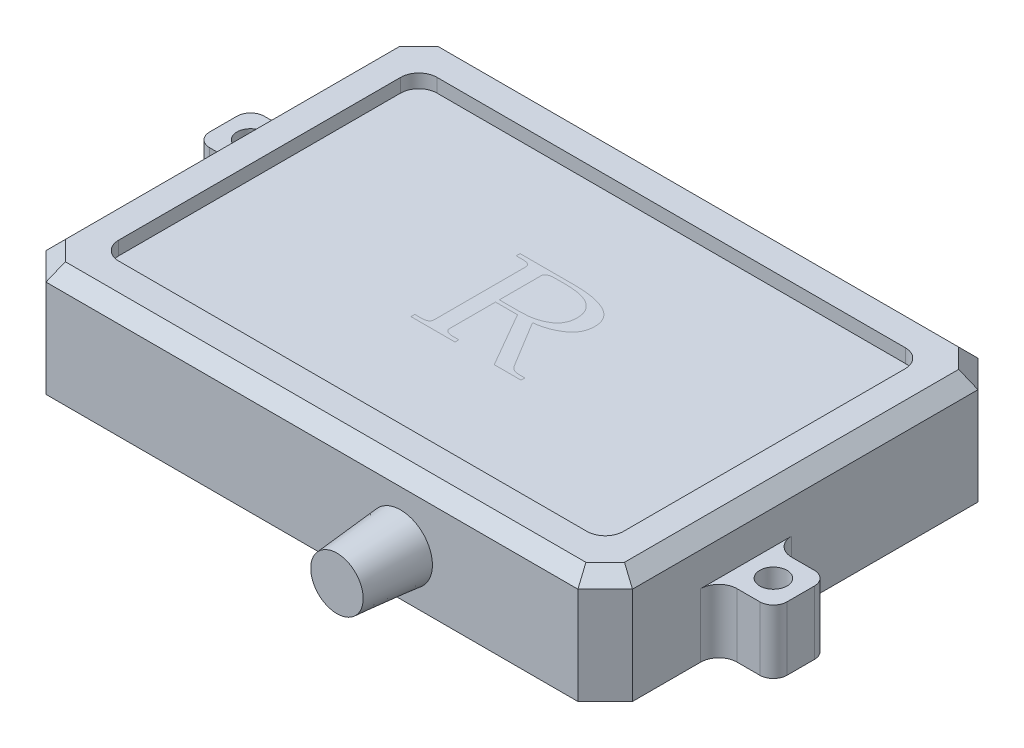
from build123d import *

# Parameters (mm, degrees)
EXTRUDE_1_DEPTH     = 12.2
CHAMFER_1_SIZE      = 1.5
CUT_EXTRUDE_1_DEPTH = 1.5
SKETCH_3_R          = 1.5
EXTRUDE_2_DEPTH     = 7
FILLET_1_R          = 2
SKETCH_4_R          = 3.5
EXTRUDE_3_DEPTH     = 7
EXTRUDE_3_TAPER     = 5
SKETCH_5_W          = 8
SKETCH_5_H          = 9
CUT_EXTRUDE_2_DEPTH = 2
SKETCH_6_R          = 2
SKETCH_6_W          = 6
SKETCH_6_H          = 1.5
CUT_EXTRUDE_3_DEPTH = 3


with BuildPart() as part:
    # 草图1 → 凸台-拉伸1 (new body)
    with BuildSketch(Plane(origin=(0, 0, 0), x_dir=(1, 0, 0), z_dir=(0, 1, 0))):
        Polygon((-32.25, 19), (-29.25, 22), (29.25, 22), (32.25, 19), (32.25, -19), (29.25, -22), (-29.25, -22), (-32.25, -19), align=None)
    extrude(amount=EXTRUDE_1_DEPTH)

    # 倒角1
    chamfer_1_edges = [part.edges().sort_by_distance(p)[0] for p in [
        (0, 12.2, 22),
        (30.75, 12.2, 20.5),
        (32.25, 12.2, 0),
        (30.75, 12.2, -20.5),
        (0, 12.2, -22),
        (-30.75, 12.2, -20.5),
        (-32.25, 12.2, 0),
        (-30.75, 12.2, 20.5),
    ]]
    chamfer(chamfer_1_edges, length=CHAMFER_1_SIZE)

    # 草图2 → 切除-拉伸1 (cut)
    with BuildSketch(Plane(origin=(0, 12.2, 0), x_dir=(1, 0, 0), z_dir=(0, 1, 0))):
        with BuildLine():
            Line((-25.75, 17.5), (25.75, 17.5))
            ThreePointArc((25.75, 17.5), (27.164213562, 16.914213562), (27.75, 15.5))
            Line((27.75, 15.5), (27.75, -15.5))
            ThreePointArc((27.75, -15.5), (27.164213562, -16.914213562), (25.75, -17.5))
            Line((25.75, -17.5), (-25.75, -17.5))
            ThreePointArc((-25.75, -17.5), (-27.164213562, -16.914213562), (-27.75, -15.5))
            Line((-27.75, -15.5), (-27.75, 15.5))
            ThreePointArc((-27.75, 15.5), (-27.164213562, 16.914213562), (-25.75, 17.5))
        make_face()
    extrude(amount=-CUT_EXTRUDE_1_DEPTH, mode=Mode.SUBTRACT)

    # 草图3 → 凸台-拉伸2 (add)
    # profile 1 of 2: a face of its own
    with BuildSketch(Plane.XZ):
        with BuildLine():
            Line((32.25, 9.5), (36.75, 9.5))
            ThreePointArc((36.75, 9.5), (37.810660172, 9.060660172), (38.25, 8))
            Line((38.25, 8), (38.25, 5))
            ThreePointArc((38.25, 5), (37.810660172, 3.939339828), (36.75, 3.5))
            Line((36.75, 3.5), (32.25, 3.5))
            Line((32.25, 3.5), (32.25, 9.5))
        make_face()
        with Locations(Location((35.25, 6.5, 0), (0, 0, 270))):
            Circle(SKETCH_3_R, mode=Mode.SUBTRACT)
    # profile 2 of 2: a face of its own
    with BuildSketch(Plane.XZ):
        with BuildLine():
            Line((-32.25, -3.5), (-36.75, -3.5))
            ThreePointArc((-36.75, -3.5), (-37.810660172, -3.939339828), (-38.25, -5))
            Line((-38.25, -5), (-38.25, -8))
            ThreePointArc((-38.25, -8), (-37.810660172, -9.060660172), (-36.75, -9.5))
            Line((-36.75, -9.5), (-32.25, -9.5))
            Line((-32.25, -9.5), (-32.25, -3.5))
        make_face()
        with Locations(Location((-35.25, -6.5, 0), (0, 0, 270))):
            Circle(SKETCH_3_R, mode=Mode.SUBTRACT)
    extrude(amount=-EXTRUDE_2_DEPTH)

    # 圆角1
    fillet_1_edges = [part.edges().sort_by_distance(p)[0] for p in [
        (32.25, 3.5, 3.5),
        (32.25, 3.5, 9.5),
        (-32.25, 3.5, -3.5),
        (-32.25, 3.5, -9.5),
    ]]
    fillet(fillet_1_edges, radius=FILLET_1_R)

    # 草图4 → 凸台-拉伸3 (add)
    with BuildSketch(Plane.XY.offset(22)):
        with Locations((9.75, 5)):
            Circle(SKETCH_4_R)
    extrude(amount=EXTRUDE_3_DEPTH, taper=EXTRUDE_3_TAPER)

    # 草图5 → 切除-拉伸2 (cut)
    with BuildSketch(Plane(origin=(0, 0, -22), x_dir=(-1, 0, 0), z_dir=(0, 0, -1))):
        with BuildLine():
            Line((-23.25, 4), (-23.25, 0))
            Line((-23.25, 0), (2.75, 0))
            Line((2.75, 0), (2.75, 4))
            ThreePointArc((2.75, 4), (-1.25, 8), (-5.25, 4))
            Line((-5.25, 4), (-6.25, 4))
            ThreePointArc((-6.25, 4), (-10.25, 8), (-14.25, 4))
            Line((-14.25, 4), (-15.25, 4))
            ThreePointArc((-15.25, 4), (-19.25, 8), (-23.25, 4))
        make_face()
        with Locations((13.25, 4.5)):
            Rectangle(SKETCH_5_W, SKETCH_5_H)
    extrude(amount=-CUT_EXTRUDE_2_DEPTH, mode=Mode.SUBTRACT)

    # 草图6 → 切除-拉伸3 (cut)
    with BuildSketch(Plane(origin=(0, 0, -20), x_dir=(-1, 0, 0), z_dir=(0, 0, -1))):
        with Locations((-19.25, 4)):
            Circle(SKETCH_6_R)
        with Locations((-10.25, 4)):
            Circle(SKETCH_6_R)
        with Locations((-1.25, 4)):
            Circle(SKETCH_6_R)
        with Locations((13.25, 7.25)):
            Rectangle(SKETCH_6_W, SKETCH_6_H)
    extrude(amount=-CUT_EXTRUDE_3_DEPTH, mode=Mode.SUBTRACT)


solid = part.part
